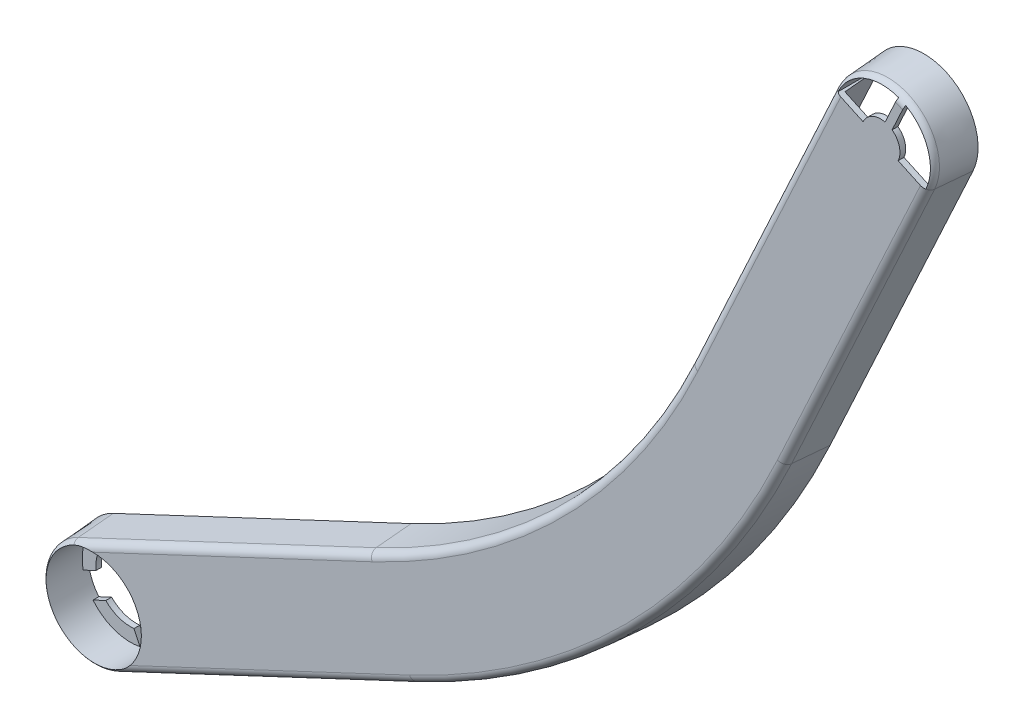
from build123d import *

# Parameters (mm, degrees)
EXTRUSION2_DEPTH        = 11.2
EXTRUSION2_DRAFT        = -4
COQUE1_T                = -1.5
CONG_1_R                = 2
ESQUISSE4_R             = 12.5
ENL_V_MAT_EXTRU_1_DEPTH = 190.035497549
EXTRUSION3_START        = -1.5
EXTRUSION3_DEPTH        = 1.5
EXTRUSION4_DEPTH        = 1
EXTRUSION5_DEPTH        = 1


with BuildPart() as part:
    # Esquisse3 → Extrusion2 (with draft: the straight prism first)
    with BuildSketch(Plane(origin=(0, 0, -6.5), x_dir=(-1, 0, 0), z_dir=(0, 0, -1))):
        with BuildLine():
            Line((-34.418091678, 13.052373199), (-71.398662192, 93.016853596))
            ThreePointArc((-71.398662192, 93.016853596), (-89.98211464, 99.847321744), (-96.812582788, 81.263869296))
            Line((-96.812582788, 81.263869296), (-59.832012274, 1.299388899))
            ThreePointArc((-59.832012274, 1.299388899), (-20.171981407, -55.724047413), (36.599420799, -95.744020285))
            Line((36.599420799, -95.744020285), (113.622178214, -131.957364461))
            ThreePointArc((113.622178214, -131.957364461), (132.248468989, -125.244593651), (125.535698179, -106.618302875))
            Line((125.535698179, -106.618302875), (48.512940764, -70.4049587))
            ThreePointArc((48.512940764, -70.4049587), (-0.310465133, -35.987782029), (-34.418091678, 13.052373199))
        make_face()
    extrude(amount=-EXTRUSION2_DEPTH)
    # Extrusion2: the draft: its side faces are tilted about the plane it starts from
    extrusion2_sides = [part.faces().sort_by_distance(p)[0] for p in [
        (52.908376935, 53.034613397, -0.9),
        (89.98211464, 99.847321744, -0.9),
        (78.322297531, 41.281629097, -0.9),
        (20.171981407, -55.724047413, -0.9),
        (-75.110799506, -113.850692373, -0.9),
        (-132.248468989, -125.244593651, -0.9),
        (-87.024319472, -88.511630788, -0.9),
        (0.310465133, -35.987782029, -0.9),
    ]]
    draft(extrusion2_sides, Plane(origin=(0, 0, -6.5), x_dir=(-1, 0, 0), z_dir=(0, 0, -1)), EXTRUSION2_DRAFT)

    # Coque1
    coque1_openings = [part.faces().sort_by_distance(p)[0] for p in [
        (55.899933032, 51.651130998, -6.5),
    ]]
    offset(amount=COQUE1_T, openings=coque1_openings, kind=Kind.INTERSECTION)

    # Congé1
    cong_1_edges = [part.edges().sort_by_distance(p)[0] for p in [
        (89.653375151, 99.136475965, 4.7),
        (77.611451752, 41.610368587, 4.7),
        (19.616440402, -55.172009765, 4.7),
        (-75.444029294, -113.141940455, 4.7),
        (-131.539717071, -124.911363863, 4.7),
        (-86.691089684, -89.220382705, 4.7),
        (0.866006138, -36.539819677, 4.7),
        (53.619222714, 52.705873908, 4.7),
    ]]
    fillet(cong_1_edges, radius=CONG_1_R)

    # Esquisse4 → Enlèv. mat.-Extru.1 (cut, through all)
    with BuildSketch(Plane.XY.offset(4.7)):
        with Locations(Location((-119.578938197, -119.287833668, 0), (0, 0, 319.931231963))):
            Circle(ESQUISSE4_R)
        with BuildLine():
            Line((88.428033532, 98.869247275), (85.254326361, 92.00662073))
            ThreePointArc((85.254326361, 92.00662073), (81.917712078, 91.636253796), (79.567422384, 89.239108642))
            Line((79.567422384, 89.239108642), (72.760122224, 92.387229437))
            ThreePointArc((72.760122224, 92.387229437), (79.327015541, 98.690898906), (88.428033532, 98.869247275))
        make_face()
        with BuildLine():
            Line((90.243313574, 98.029748396), (87.069606403, 91.167121851))
            ThreePointArc((87.069606403, 91.167121851), (88.948261451, 88.384888621), (88.643822596, 85.041614249))
            Line((88.643822596, 85.041614249), (95.451122756, 81.893493455))
            ThreePointArc((95.451122756, 81.893493455), (96.001427458, 90.979609311), (90.243313574, 98.029748396))
        make_face()
    extrude(amount=-ENL_V_MAT_EXTRU_1_DEPTH, mode=Mode.SUBTRACT)

    # Esquisse5 → Extrusion3 (add)
    with BuildSketch(Plane(origin=(0, 0, -6.5), x_dir=(-1, 0, 0), z_dir=(0, 0, -1)).offset(EXTRUSION3_START)):
        with BuildLine():
            Line((127.456927912, -109.582820632), (125.904179404, -112.885386975))
            ThreePointArc((125.904179404, -112.885386975), (128.045865957, -116.236418537), (128.534282025, -120.183275965))
            Line((128.534282025, -120.183275965), (131.836848368, -121.736024473))
            ThreePointArc((131.836848368, -121.736024473), (131.338560086, -115.049757096), (127.456927912, -109.582820632))
        make_face()
        with BuildLine():
            Line((125.98138489, -125.613074876), (129.283951233, -127.165823384))
            ThreePointArc((129.283951233, -127.165823384), (123.817014768, -131.047455557), (117.130747392, -131.54574384))
            Line((117.130747392, -131.54574384), (118.6834959, -128.243177497))
            ThreePointArc((118.6834959, -128.243177497), (122.630353328, -127.754761428), (125.98138489, -125.613074876))
        make_face()
    extrude(amount=EXTRUSION3_DEPTH)

    # Esquisse6 → Extrusion4 (add)
    with BuildSketch(Plane(origin=(-86.746444122, -89.10264844, 2.839512947), x_dir=(0, 0, -1), z_dir=(0.9049664851912623, 0.42548285591851137, 0))):
        with BuildLine():
            Line((-0.360487053, -4.346917634), (2.339512947, -4.346917634))
            ThreePointArc((2.339512947, -4.346917634), (2.693066338, -4.200471025), (2.839512947, -3.846917634))
            Line((2.839512947, -3.846917634), (2.839512947, -2.846917634))
            ThreePointArc((2.839512947, -2.846917634), (2.985959557, -2.493364244), (3.339512947, -2.346917634))
            Line((3.339512947, -2.346917634), (8.339512947, -2.346917634))
            ThreePointArc((8.339512947, -2.346917634), (8.693066338, -2.200471025), (8.839512947, -1.846917634))
            Line((8.839512947, -1.846917634), (8.839512947, -0.885543888))
            Line((8.839512947, -0.885543888), (-0.360487053, -1.528870557))
            Line((-0.360487053, -1.528870557), (-0.360487053, -4.346917634))
        make_face()
        with BuildLine():
            Line((-0.360487053, -22.346917634), (2.339512947, -22.346917634))
            ThreePointArc((2.339512947, -22.346917634), (2.693066338, -22.493364244), (2.839512947, -22.846917634))
            Line((2.839512947, -22.846917634), (2.839512947, -23.846917634))
            ThreePointArc((2.839512947, -23.846917634), (2.985959557, -24.200471025), (3.339512947, -24.346917634))
            Line((3.339512947, -24.346917634), (8.339512947, -24.346917634))
            ThreePointArc((8.339512947, -24.346917634), (8.693066338, -24.493364244), (8.839512947, -24.846917634))
            Line((8.839512947, -24.846917634), (8.839512947, -25.808291381))
            Line((8.839512947, -25.808291381), (-0.360487053, -25.164964712))
            Line((-0.360487053, -25.164964712), (-0.360487053, -22.346917634))
        make_face()
    extrude(amount=EXTRUSION4_DEPTH)

    # Esquisse7 → Extrusion5 (add)
    with BuildSketch(Plane(origin=(52.908376935, 53.034613397, -6.5), x_dir=(-0.9076400212812858, 0.4197494392712243, 0), z_dir=(0.4197494392712243, 0.9076400212812858, 0))):
        with BuildLine():
            Line((-23, 9.7), (-23, 7))
            ThreePointArc((-23, 7), (-23.146446609, 6.646446609), (-23.5, 6.5))
            Line((-23.5, 6.5), (-24.5, 6.5))
            ThreePointArc((-24.5, 6.5), (-24.853553391, 6.353553391), (-25, 6))
            Line((-25, 6), (-25, 1))
            ThreePointArc((-25, 1), (-25.146446609, 0.646446609), (-25.5, 0.5))
            Line((-25.5, 0.5), (-26.461373747, 0.5))
            Line((-26.461373747, 0.5), (-25.818047077, 9.7))
            Line((-25.818047077, 9.7), (-23, 9.7))
        make_face()
        with BuildLine():
            Line((-5, 9.7), (-5, 7))
            ThreePointArc((-5, 7), (-4.853553391, 6.646446609), (-4.5, 6.5))
            Line((-4.5, 6.5), (-3.5, 6.5))
            ThreePointArc((-3.5, 6.5), (-3.146446609, 6.353553391), (-3, 6))
            Line((-3, 6), (-3, 1))
            ThreePointArc((-3, 1), (-2.853553391, 0.646446609), (-2.5, 0.5))
            Line((-2.5, 0.5), (-1.538626253, 0.5))
            Line((-1.538626253, 0.5), (-2.181952923, 9.7))
            Line((-2.181952923, 9.7), (-5, 9.7))
        make_face()
    extrude(amount=EXTRUSION5_DEPTH)


solid = part.part
